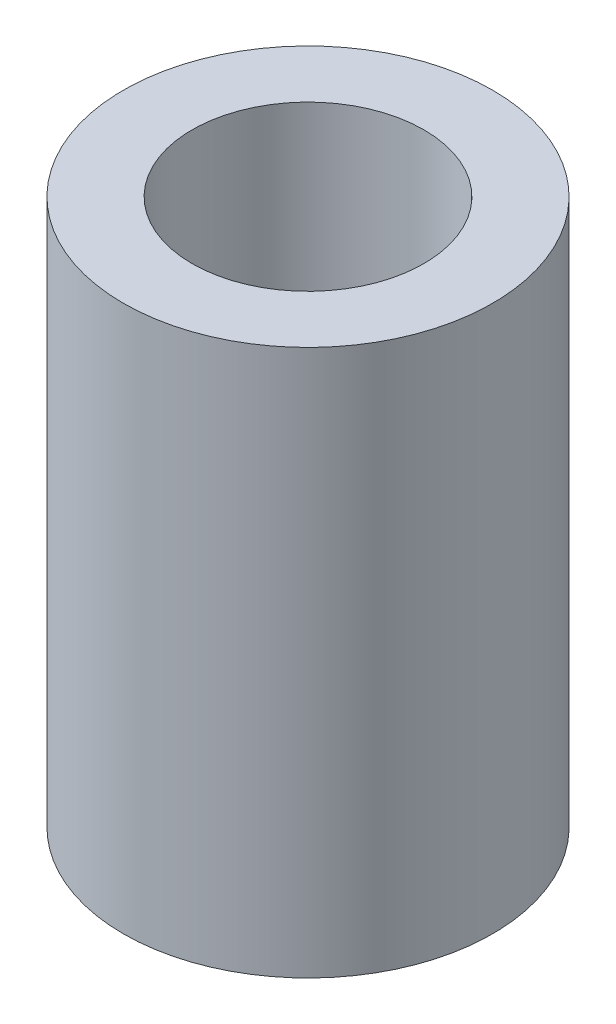
from build123d import *

# Parameters (mm, degrees)
SKETCH1_R           = 5.375
SKETCH1_R_2         = 3.375
BOSS_EXTRUDE1_DEPTH = 15.9


with BuildPart() as part:
    # Sketch1 → Boss-Extrude1 (new body)
    with BuildSketch(Plane(origin=(0, 0, 0), x_dir=(1, 0, 0), z_dir=(0, 1, 0))):
        with Locations(Location((0, 0, 0), (0, 0, 270))):
            Circle(SKETCH1_R)
        with Locations(Location((0, 0, 0), (0, 0, 270))):
            Circle(SKETCH1_R_2, mode=Mode.SUBTRACT)
    extrude(amount=BOSS_EXTRUDE1_DEPTH)


solid = part.part
